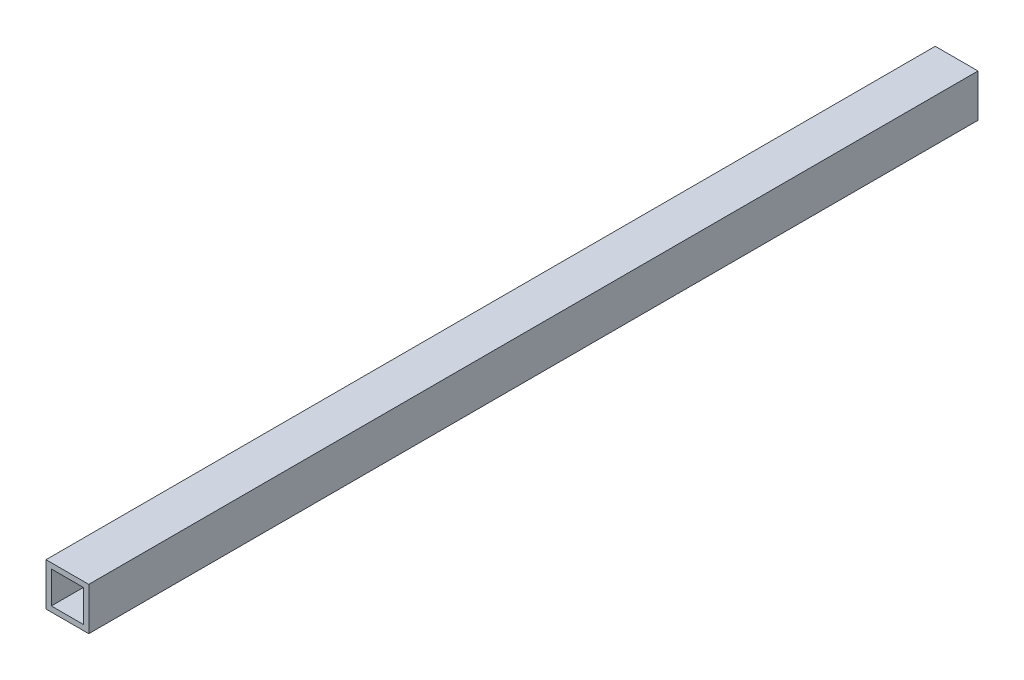
from build123d import *

# Parameters (mm, degrees)
BOSS_EXTRUDE1_DEPTH      = 264.16
BOSS_EXTRUDE1_DEPTH_BACK = 264.16
SKETCH3_W                = 25.4
SKETCH3_H                = 25.4
SKETCH3_W_2              = 19.05
SKETCH3_H_2              = 19.05


with BuildPart() as part:
    # Sketch3 → Boss-Extrude1 (new, two sides: drawn at the far end of the back side and taken through both)
    with BuildSketch(Plane.XY.offset(-BOSS_EXTRUDE1_DEPTH_BACK)):
        Rectangle(SKETCH3_W, SKETCH3_H)
        Rectangle(SKETCH3_W_2, SKETCH3_H_2, mode=Mode.SUBTRACT)
    extrude(amount=BOSS_EXTRUDE1_DEPTH + BOSS_EXTRUDE1_DEPTH_BACK)


solid = part.part
